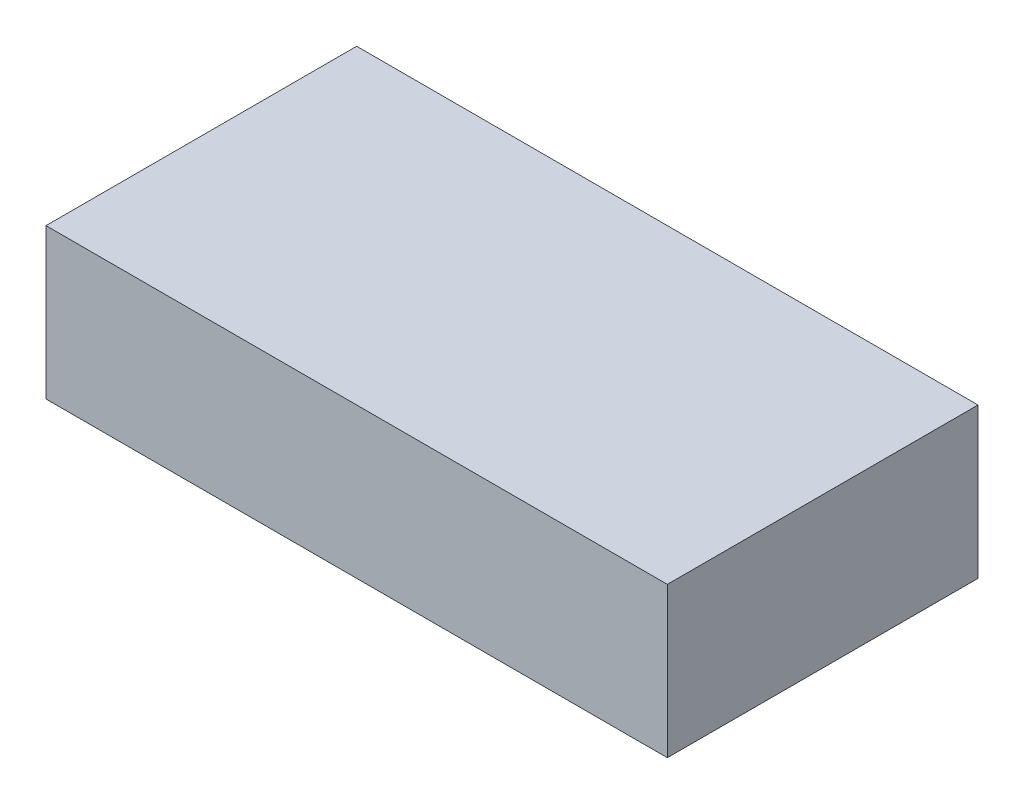
from build123d import *

# Parameters (mm, degrees)
SKETCH_1_W      = 60
SKETCH_1_H      = 30
EXTRUDE_1_DEPTH = 14.5


with BuildPart() as part:
    # 草图1 → 凸台-拉伸1 (new body)
    with BuildSketch(Plane(origin=(0, 0, 0), x_dir=(1, 0, 0), z_dir=(0, 1, 0))):
        with Locations((30, 15)):
            Rectangle(SKETCH_1_W, SKETCH_1_H)
    extrude(amount=EXTRUDE_1_DEPTH)


solid = part.part
